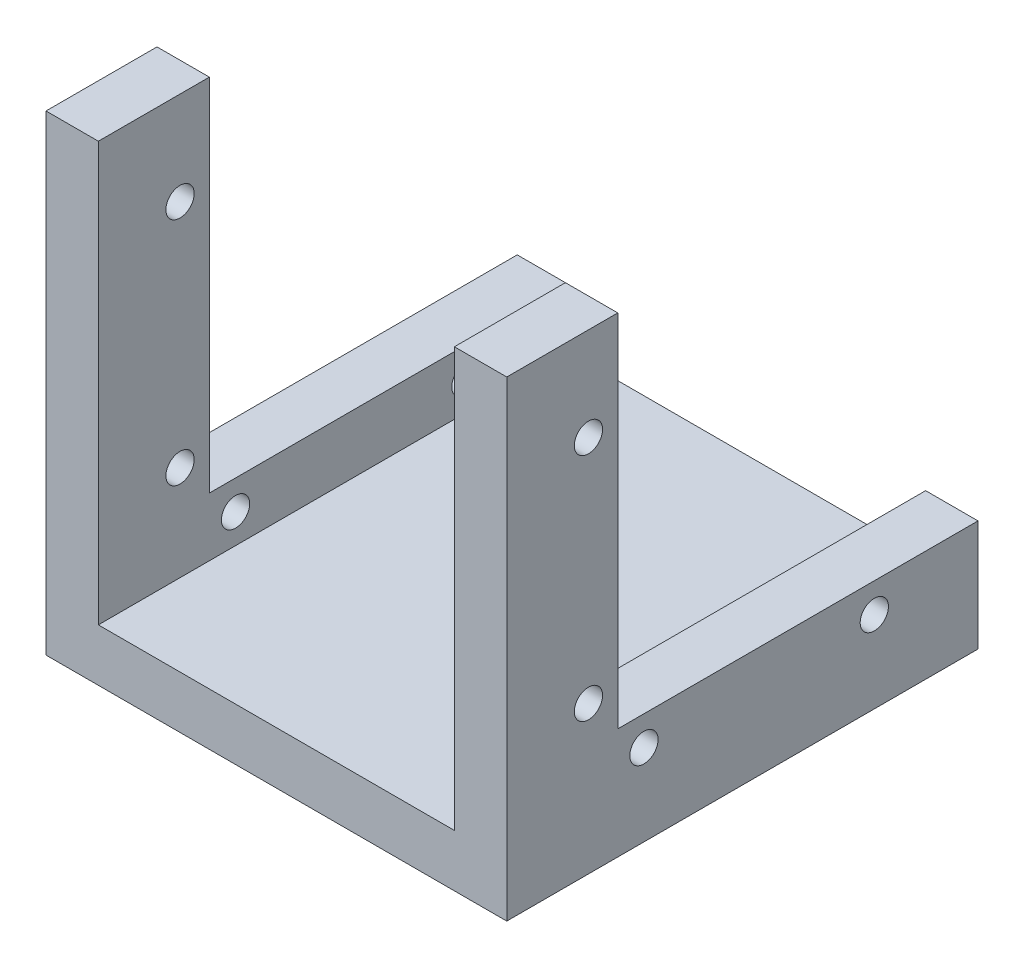
from build123d import *

# Parameters (mm, degrees)
BOSS_EXTRUDE1_DEPTH     = 45
CUT_EXTRUDE1_DEPTH      = 75.639131828
CUT_EXTRUDE1_DEPTH_BACK = 75.639131828
SKETCH3_R               = 1.35
SKETCH3_W               = 34.4
SKETCH3_H               = 34.4


with BuildPart() as part:
    # Sketch1 → Boss-Extrude1 (new body)
    with BuildSketch(Plane.XY):
        Polygon((0, 0), (44, 0), (44, 45), (39, 45), (39, 5), (5, 5), (5, 45), (0, 45), align=None)
    extrude(amount=BOSS_EXTRUDE1_DEPTH)

    # Sketch3 → Cut-Extrude1 (cut, two sides: drawn at the far end of the back side and taken through both)
    with BuildSketch(Plane(origin=(5, 0, 0), x_dir=(0, 0, -1), z_dir=(1, 0, 0)).offset(-CUT_EXTRUDE1_DEPTH_BACK)):
        with Locations((-37.2, 36.1)):
            Circle(SKETCH3_R)
        with Locations((-37.2, 14.1)):
            Circle(SKETCH3_R)
        with Locations((-31.9, 7.8)):
            Circle(SKETCH3_R)
        with Locations((-9.9, 7.8)):
            Circle(SKETCH3_R)
        with Locations((-17.2, 27.8)):
            Rectangle(SKETCH3_W, SKETCH3_H)
    extrude(amount=CUT_EXTRUDE1_DEPTH + CUT_EXTRUDE1_DEPTH_BACK, mode=Mode.SUBTRACT)


solid = part.part
